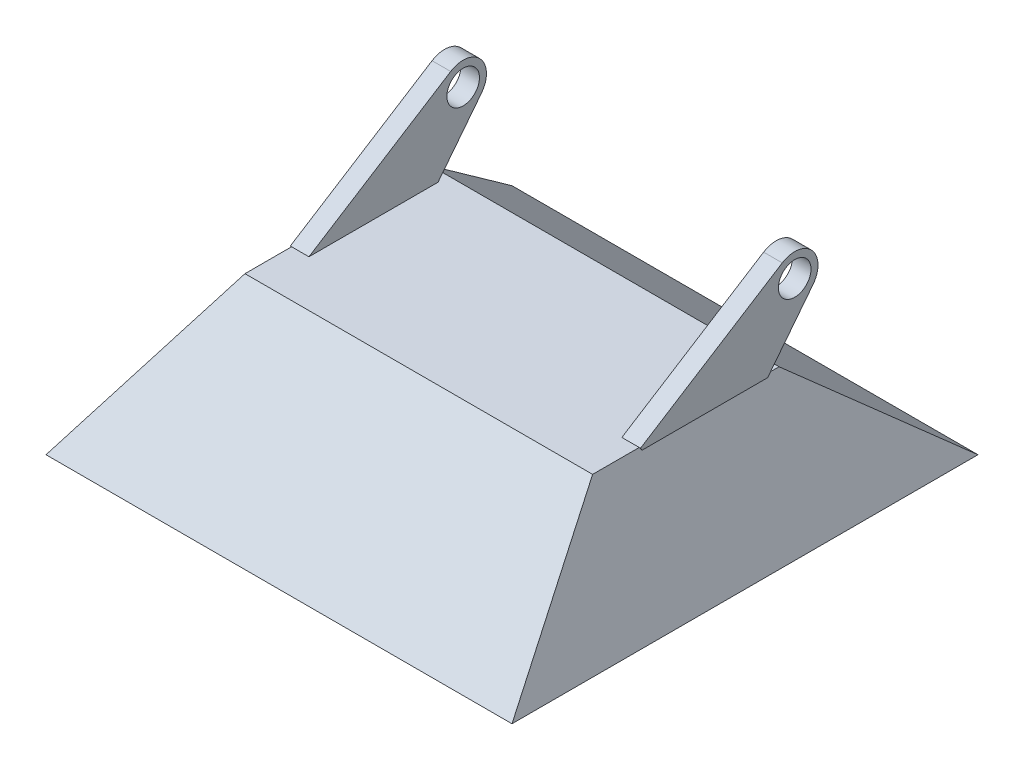
from build123d import *

# Parameters (mm, degrees)
SKETCH4_R           = 137.5
CUT_EXTRUDE1_DEPTH  = 20
BOSS_EXTRUDE1_START = 167.87
BOSS_EXTRUDE1_DEPTH = 20
SKETCH6_R           = 17.5
CUT_EXTRUDE2_DEPTH  = 553.13688256


with BuildPart() as part:
    # Sketch3 → Loft1 section 0
    with BuildSketch(Plane(origin=(0, 125, 0), x_dir=(1, 0, 0), z_dir=(0, 1, 0))):
        with BuildLine():
            Line((186.5, -100), (-186.5, -100))
            Line((-186.5, -100), (-186.5, 100))
            Line((-186.5, 100), (186.5, 100))
            Line((186.5, 100), (186.5, -100))
        make_face()
    # Sketch2 → Loft1 section 1
    with BuildSketch(Plane(origin=(0, 0, 0), x_dir=(1, 0, 0), z_dir=(0, 1, 0))):
        with BuildLine():
            Line((250, -250), (-250, -250))
            Line((-250, -250), (-250, 250))
            Line((-250, 250), (250, 250))
            Line((250, 250), (250, -250))
        make_face()
    loft()

    # Sketch4 → Cut-Extrude1 (cut)
    with BuildSketch(Plane.XZ):
        with Locations(Location((0, 0, 0), (0, 0, 270))):
            Circle(SKETCH4_R)
    extrude(amount=-CUT_EXTRUDE1_DEPTH, mode=Mode.SUBTRACT)

    # Sketch5 → Boss-Extrude1 (add)
    with BuildSketch(Plane(origin=(0, 54.782797639, 0), x_dir=(0, 0, -1), z_dir=(1, 0, 0)).offset(BOSS_EXTRUDE1_START)):
        with BuildLine():
            Line((102.114142863, 166.350579801), (-50, 70.217202361))
            Line((-50, 70.217202361), (11.864642245, -27.672701013))
            Line((11.864642245, -27.672701013), (135.154881767, 129.805922421))
            ThreePointArc((135.154881767, 129.805922421), (134.01437354, 161.983484202), (102.114142863, 166.350579801))
        make_face()
    boss_extrude1 = extrude(amount=BOSS_EXTRUDE1_DEPTH)

    # Sketch6 → Cut-Extrude2 (cut, through all)
    with BuildSketch(Plane(origin=(187.87, 0, 0), x_dir=(0, 0, -1), z_dir=(1, 0, 0))):
        with Locations((115.470053838, 200)):
            Circle(SKETCH6_R)
    cut_extrude2 = extrude(amount=-CUT_EXTRUDE2_DEPTH, mode=Mode.SUBTRACT)

    # Mirror1: Boss-Extrude1, Cut-Extrude2 across plane
    add(boss_extrude1.mirror(Plane(origin=(0, 0, 0), x_dir=(0, 0, 1), z_dir=(1, 0, 0))))
    add(cut_extrude2.mirror(Plane(origin=(0, 0, 0), x_dir=(0, 0, 1), z_dir=(1, 0, 0))), mode=Mode.SUBTRACT)


solid = part.part
